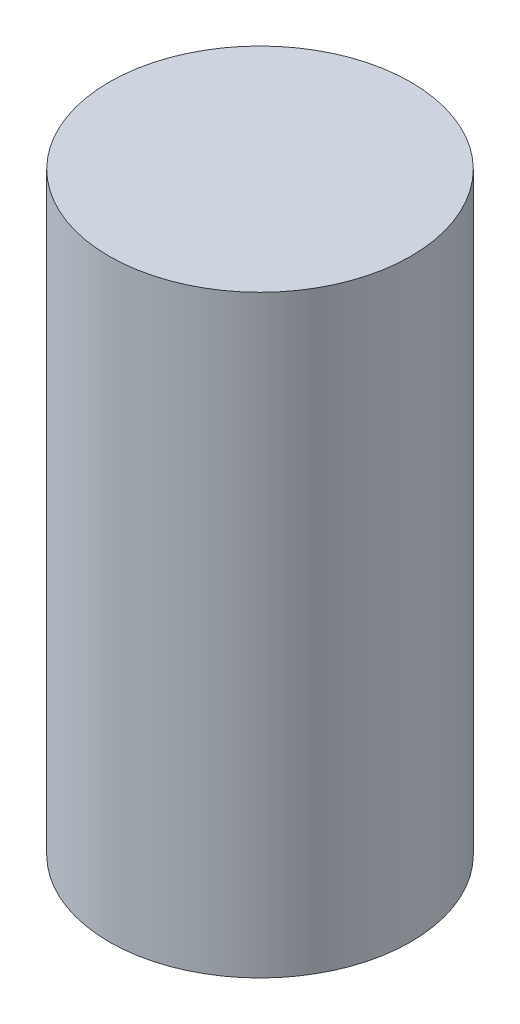
from build123d import *

# Parameters (mm, degrees)
SKETCH1_R           = 2.54
BOSS_EXTRUDE1_DEPTH = 10


with BuildPart() as part:
    # Sketch1 → Boss-Extrude1 (new body)
    with BuildSketch(Plane(origin=(0, 0, 0), x_dir=(1, 0, 0), z_dir=(0, 1, 0))):
        with Locations(Location((0, 0, 0), (0, 0, 270))):
            Circle(SKETCH1_R)
    extrude(amount=BOSS_EXTRUDE1_DEPTH)


solid = part.part
